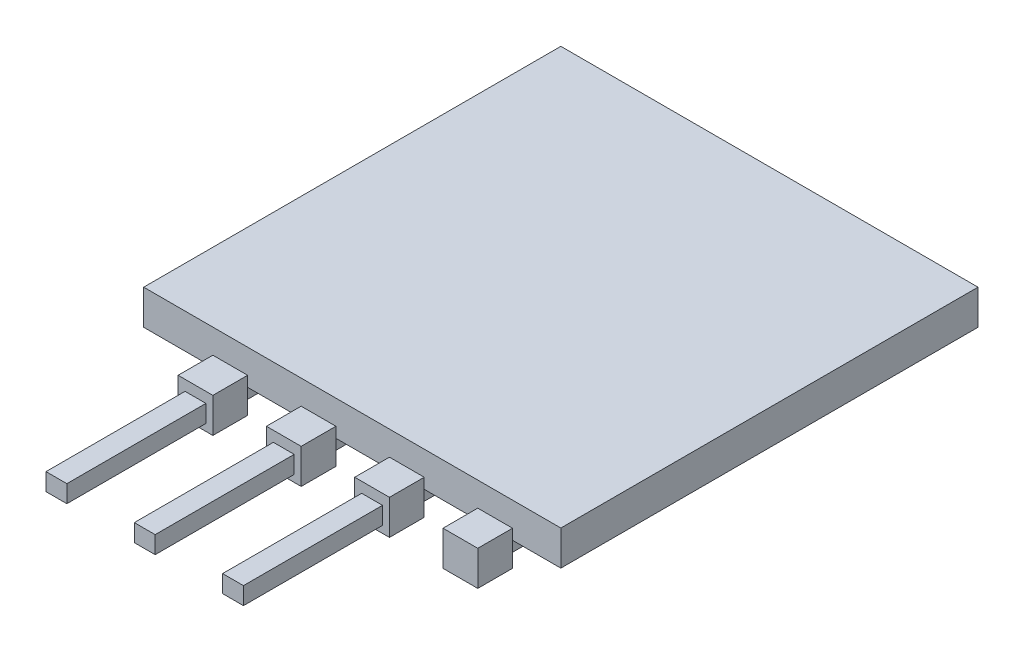
from build123d import *

# Parameters (mm, degrees)
SKETCH1_W           = 12
SKETCH1_H           = 12
BOSS_EXTRUDE1_DEPTH = 1
SKETCH2_W           = 0.6
SKETCH2_H           = 0.5
BOSS_EXTRUDE2_DEPTH = 5
SKETCH2_3_W         = 0.6
SKETCH2_3_H         = 0.5
BOSS_EXTRUDE3_DEPTH = 2
LPATTERN2_COUNT     = 4
LPATTERN2_PITCH     = 2.54
LPATTERN3_COUNT     = 3
LPATTERN3_PITCH     = 2.54
SKETCH3_W           = 1
SKETCH3_H           = 1
BOSS_EXTRUDE4_DEPTH = 1
LPATTERN4_COUNT     = 4
LPATTERN4_PITCH     = 2.54


with BuildPart() as part:
    # Sketch1 → Boss-Extrude1 (new body)
    with BuildSketch(Plane(origin=(0, 0, 0), x_dir=(1, 0, 0), z_dir=(0, 1, 0))):
        Rectangle(SKETCH1_W, SKETCH1_H)
    extrude(amount=BOSS_EXTRUDE1_DEPTH)



with BuildPart() as body_2:
    # Sketch2 → Boss-Extrude2 (new body)
    with BuildSketch(Plane.XY.offset(6)):
        with Locations((-3.51, -0.25)):
            Rectangle(SKETCH2_W, SKETCH2_H)
    boss_extrude2 = extrude(amount=BOSS_EXTRUDE2_DEPTH)


with BuildPart() as part_1:
    add(part.part)

    add(body_2.part)  # Boss-Extrude3 merges body 2
    # Sketch2<3> → Boss-Extrude3 (add)
    with BuildSketch(Plane.XY.offset(6)):
        with Locations((-3.51, -0.25)):
            Rectangle(SKETCH2_3_W, SKETCH2_3_H)
    boss_extrude3 = extrude(amount=-BOSS_EXTRUDE3_DEPTH)

    # LPattern2: Boss-Extrude3 ×4
    with Locations(*[(i * LPATTERN2_PITCH, 0, 0) for i in range(1, LPATTERN2_COUNT)]):
        add(boss_extrude3)

    # LPattern3: Boss-Extrude2 ×3
    with Locations(*[(i * LPATTERN3_PITCH, 0, 0) for i in range(1, LPATTERN3_COUNT)]):
        add(boss_extrude2)

    # Sketch3 → Boss-Extrude4 (add)
    with BuildSketch(Plane.XY.offset(6)):
        with Locations((4.11, -0.2)):
            Rectangle(SKETCH3_W, SKETCH3_H)
    boss_extrude4 = extrude(amount=BOSS_EXTRUDE4_DEPTH)

    # LPattern4: Boss-Extrude4 ×4
    with Locations(*[(-i * LPATTERN4_PITCH, 0, 0) for i in range(1, LPATTERN4_COUNT)]):
        add(boss_extrude4)


solid = part_1.part
